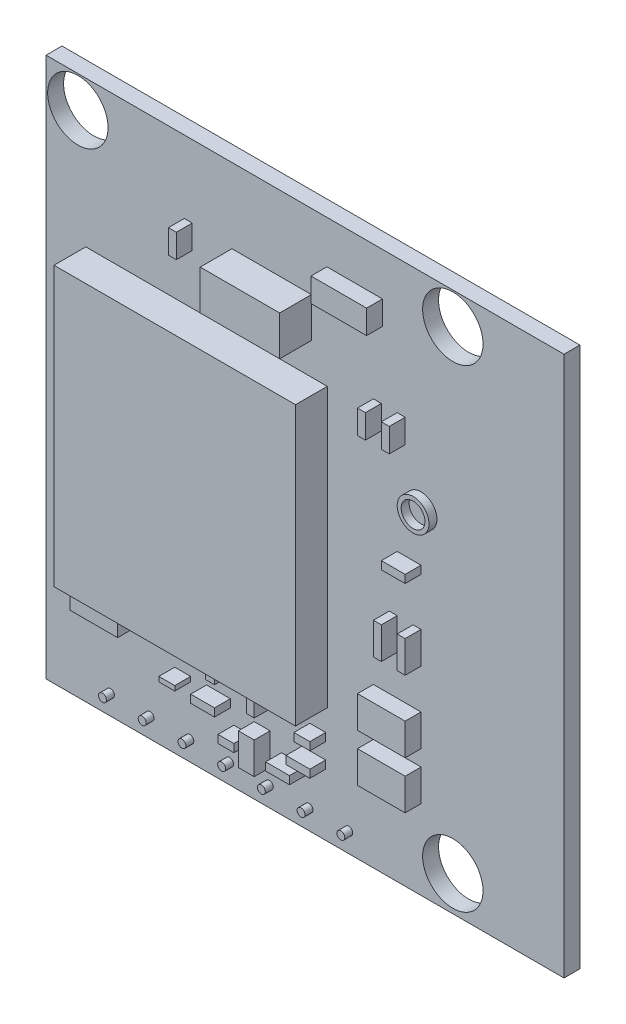
from build123d import *

# Parameters (mm, degrees)
ESQUISSE1_W             = 32.6
ESQUISSE1_H             = 34
BOSS_EXTRU_1_DEPTH      = 1
ESQUISSE2_W             = 5
ESQUISSE2_H             = 2.5
ESQUISSE2_W_2           = 15.2
ESQUISSE2_H_2           = 17.52
ESQUISSE2_W_3           = 3
ESQUISSE2_H_3           = 1
ESQUISSE2_H_4           = 2
BOSS_EXTRU_2_DEPTH      = 1
ESQUISSE3_W             = 15.2
ESQUISSE3_H             = 17.52
ESQUISSE3_W_2           = 5
ESQUISSE3_H_2           = 2.5
BOSS_EXTRU_3_DEPTH      = 1
ESQUISSE4_W             = 0.5
ESQUISSE4_H             = 2
ESQUISSE4_W_2           = 1.5
ESQUISSE4_H_2           = 0.5
ESQUISSE4_H_3           = 1.5
ESQUISSE4_W_3           = 3.5
ESQUISSE4_W_4           = 1
ESQUISSE4_H_4           = 1
ESQUISSE4_H_5           = 0.3
ESQUISSE4_W_5           = 0.553112931
ESQUISSE4_H_6           = 0.835313405
BOSS_EXTRU_4_DEPTH      = 1
ESQUISSE5_R             = 1
ESQUISSE5_R_2           = 0.75
BOSS_EXTRU_5_DEPTH      = 0.5
ESQUISSE6_R             = 1.9
ENL_V_MAT_EXTRU_1_DEPTH = 8.5
ESQUISSE7_W             = 18.1
ESQUISSE7_H             = 2.5
BOSS_EXTRU_6_DEPTH      = 2.5
BOSS_EXTRU_7_DEPTH      = 5
BOSS_EXTRU_7_DEPTH_BACK = 4
ESQUISSE8_R             = 0.25


with BuildPart() as part:
    # Esquisse1 → Boss.-Extru.1 (new body)
    with BuildSketch(Plane.XY):
        with Locations((-16.3, 17)):
            Rectangle(ESQUISSE1_W, ESQUISSE1_H)
    extrude(amount=BOSS_EXTRU_1_DEPTH)

    # Esquisse2 → Boss.-Extru.2 (add)
    with BuildSketch(Plane.XY.offset(1)):
        with Locations((-18.4, 28.05)):
            Rectangle(ESQUISSE2_W, ESQUISSE2_H)
        with Locations((-22.5, 16.04)):
            Rectangle(ESQUISSE2_W_2, ESQUISSE2_H_2)
        with Locations((-28.6, 6)):
            Rectangle(ESQUISSE2_W_3, ESQUISSE2_H_3)
        with Locations((-10.5, 9)):
            Rectangle(ESQUISSE2_W_3, ESQUISSE2_H_4)
        with Locations((-10.5, 6)):
            Rectangle(ESQUISSE2_W_3, ESQUISSE2_H_4)
    extrude(amount=BOSS_EXTRU_2_DEPTH)

    # Esquisse3 → Boss.-Extru.3 (add)
    with BuildSketch(Plane.XY.offset(2)):
        with Locations((-22.5, 16.04)):
            Rectangle(ESQUISSE3_W, ESQUISSE3_H)
        with Locations((-18.4, 28.05)):
            Rectangle(ESQUISSE3_W_2, ESQUISSE3_H_2)
    extrude(amount=BOSS_EXTRU_3_DEPTH)

    # Esquisse4 → Boss.-Extru.4 (add)
    with BuildSketch(Plane.XY.offset(1)):
        with Locations((-9.25, 13.5)):
            Rectangle(ESQUISSE4_W, ESQUISSE4_H)
        with Locations((-10.75, 13.5)):
            Rectangle(ESQUISSE4_W, ESQUISSE4_H)
        with Locations((-9.75, 17.75)):
            Rectangle(ESQUISSE4_W_2, ESQUISSE4_H_2)
        with Locations((-10.25, 24.816299889)):
            Rectangle(ESQUISSE4_W, ESQUISSE4_H_3)
        with Locations((-11.75, 24.816299889)):
            Rectangle(ESQUISSE4_W, ESQUISSE4_H_3)
        with Locations((-13.17709205, 30.55)):
            Rectangle(ESQUISSE4_W_3, ESQUISSE4_H_3)
        with Locations((-23.65, 28.699378422)):
            Rectangle(ESQUISSE4_W, ESQUISSE4_H_3)
        with Locations((-15.5, 5.633321931)):
            Rectangle(ESQUISSE4_W_4, ESQUISSE4_H_2)
        with Locations((-15.75, 4.133321931)):
            Rectangle(ESQUISSE4_W_2, ESQUISSE4_H_2)
        with Locations((-19, 3.221962501)):
            Rectangle(ESQUISSE4_W_4, ESQUISSE4_H)
        with Locations((-18.75, 5.918492514)):
            Rectangle(ESQUISSE4_W, ESQUISSE4_H_4)
        with Locations((-17.030226104, 3.13997626)):
            Rectangle(ESQUISSE4_W_2, ESQUISSE4_H_2)
        with Locations((-20.280226104, 3.13997626)):
            Rectangle(ESQUISSE4_W_4, ESQUISSE4_H_2)
        with Locations((-21.75, 4.471962501)):
            Rectangle(ESQUISSE4_W_2, ESQUISSE4_H_2)
        with Locations((-24, 4.53997626)):
            Rectangle(ESQUISSE4_W_4, ESQUISSE4_H_5)
        with Locations((-21.276556466, 6.400550167)):
            Rectangle(ESQUISSE4_W_5, ESQUISSE4_H_6)
    extrude(amount=BOSS_EXTRU_4_DEPTH)

    # Esquisse5 → Boss.-Extru.5 (add)
    with BuildSketch(Plane.XY.offset(1)):
        with Locations((-9, 21)):
            Circle(ESQUISSE5_R)
        with Locations((-9, 21)):
            Circle(ESQUISSE5_R_2, mode=Mode.SUBTRACT)
    extrude(amount=BOSS_EXTRU_5_DEPTH)

    # Esquisse6 → Enlèv. mat.-Extru.1 (cut)
    with BuildSketch(Plane.XY.offset(1)):
        with Locations((-30.6, 32)):
            Circle(ESQUISSE6_R)
        with Locations((-7, 32)):
            Circle(ESQUISSE6_R)
        with Locations((-7, 2.2)):
            Circle(ESQUISSE6_R)
    extrude(amount=-ENL_V_MAT_EXTRU_1_DEPTH, mode=Mode.SUBTRACT)

    # Esquisse7 → Boss.-Extru.6 (add)
    with BuildSketch(Plane(origin=(0, 0, 0), x_dir=(-1, 0, 0), z_dir=(0, 0, -1))):
        with Locations((21.05, 1.25)):
            Rectangle(ESQUISSE7_W, ESQUISSE7_H)
    extrude(amount=BOSS_EXTRU_6_DEPTH)

    # Esquisse8 → Boss.-Extru.7 (add, two sides: drawn at the far end of the back side and taken through both)
    with BuildSketch(Plane(origin=(0, 0, -2.5), x_dir=(-1, 0, 0), z_dir=(0, 0, -1)).offset(-BOSS_EXTRU_7_DEPTH_BACK)):
        with Locations((13.55, 1.25)):
            Circle(ESQUISSE8_R)
        with Locations((16.05, 1.25)):
            Circle(ESQUISSE8_R)
        with Locations((18.55, 1.25)):
            Circle(ESQUISSE8_R)
        with Locations((21.05, 1.25)):
            Circle(ESQUISSE8_R)
        with Locations((23.55, 1.25)):
            Circle(ESQUISSE8_R)
        with Locations((26.05, 1.25)):
            Circle(ESQUISSE8_R)
        with Locations((28.55, 1.25)):
            Circle(ESQUISSE8_R)
    extrude(amount=BOSS_EXTRU_7_DEPTH + BOSS_EXTRU_7_DEPTH_BACK)


solid = part.part
